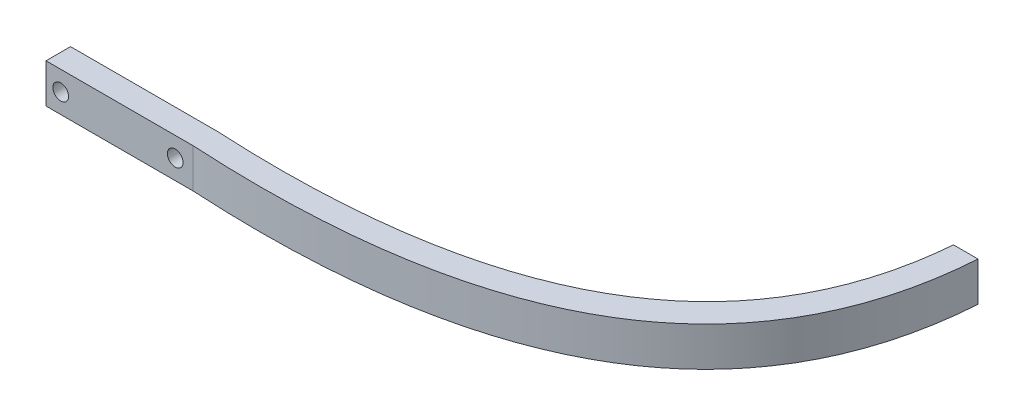
from build123d import *

# Parameters (mm, degrees)
EXTRUDE_1_DEPTH     = 8
SKETCH_2_R          = 1.6
CUT_EXTRUDE_1_DEPTH = 10


with BuildPart() as part:
    # Эскиз1 → Бобышка-Вытянуть1 (new body)
    with BuildSketch(Plane(origin=(0, 0, 0), x_dir=(1, 0, 0), z_dir=(0, 1, 0))):
        with BuildLine():
            Line((120.67483279, 57.76097026), (125.67483279, 57.76097026))
            add(Edge.make_bspline(
                [(25.67483279, -2.23902974), (121.28759337, -7.643443061), (125.67483279, 57.76097026)],
                knots=[0, 0, 0, 1, 1, 1], degree=2))
            Line((25.67483279, -2.23902974), (-4.32516721, -2.23902974))
            Line((-4.32516721, -2.23902974), (-4.32516721, 2.76097026))
            Line((-4.32516721, 2.76097026), (25.67483279, 2.76097026))
            add(Edge.make_bspline(
                [(25.67483279, 2.76097026), (115.69323106, -1.985762605), (120.67483279, 57.76097026)],
                knots=[0, 0, 0, 1, 1, 1], degree=2))
        make_face()
    extrude(amount=EXTRUDE_1_DEPTH)

    # Эскиз2 → Вырез-Вытянуть1 (cut)
    with BuildSketch(Plane(origin=(0, 0, -2.76097026), x_dir=(-1, 0, 0), z_dir=(0, 0, -1))):
        with Locations((-22.01483279, 4)):
            Circle(SKETCH_2_R)
        with Locations((1.32516721, 4)):
            Circle(SKETCH_2_R)
    extrude(amount=-CUT_EXTRUDE_1_DEPTH, mode=Mode.SUBTRACT)


solid = part.part
